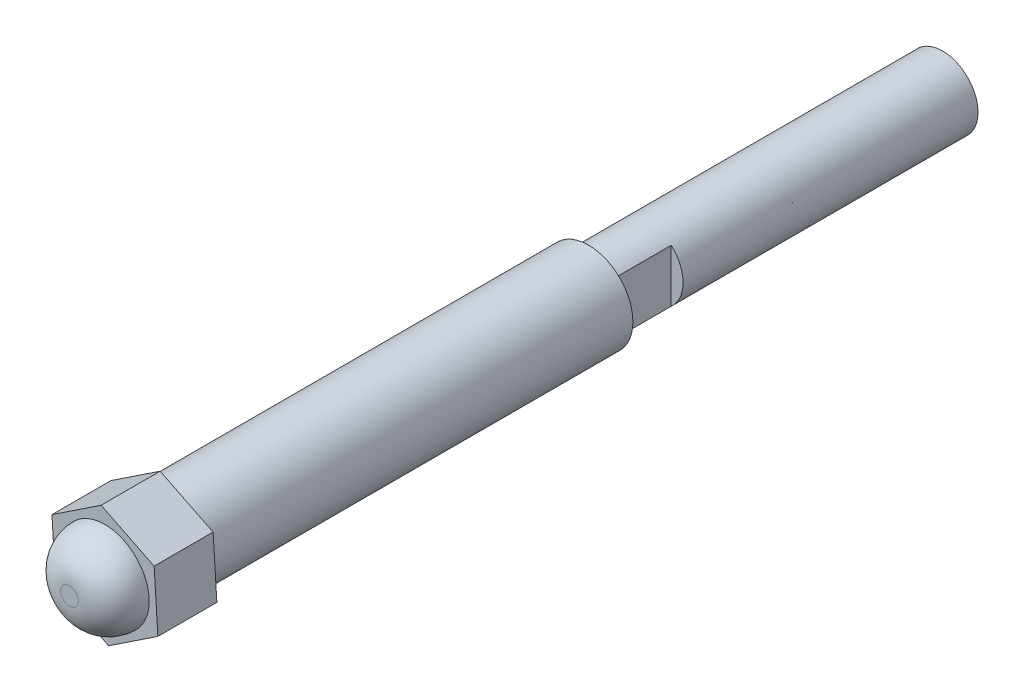
from build123d import *

# Parameters (mm, degrees)
SKETCH1_R           = 4.7625
BOSS_EXTRUDE1_DEPTH = 55.88
SKETCH2_R           = 3.81
BOSS_EXTRUDE2_DEPTH = 38.1
SKETCH3_W           = 1.27
SKETCH3_H           = 6.35
CUT_EXTRUDE1_DEPTH  = 19.05
SKETCH4_R           = 1.5875
CUT_EXTRUDE2_DEPTH  = 38.1
FILLET2_R           = 3.81
BOSS_EXTRUDE3_START = 45.72
BOSS_EXTRUDE3_DEPTH = 6.35


with BuildPart() as part:
    # Sketch1 → Boss-Extrude1 (new body)
    with BuildSketch(Plane.XY):
        Circle(SKETCH1_R)
    extrude(amount=BOSS_EXTRUDE1_DEPTH)

    # Sketch2 → Boss-Extrude2 (add)
    with BuildSketch(Plane(origin=(0, 0, 0), x_dir=(-1, 0, 0), z_dir=(0, 0, -1))):
        with Locations(Location((0, 0, 0), (0, 0, 180))):
            Circle(SKETCH2_R)
    extrude(amount=BOSS_EXTRUDE2_DEPTH)

    # Sketch3 → Cut-Extrude1 (cut, symmetric)
    with BuildSketch(Plane(origin=(0, 0, 0), x_dir=(1, 0, 0), z_dir=(0, 1, 0))):
        with Locations((-3.175, 3.175)):
            Rectangle(SKETCH3_W, SKETCH3_H)
        with Locations((3.175, 3.175)):
            Rectangle(SKETCH3_W, SKETCH3_H)
    extrude(amount=CUT_EXTRUDE1_DEPTH, both=True, mode=Mode.SUBTRACT)

    # Sketch4 → Cut-Extrude2 (cut)
    with BuildSketch(Plane(origin=(0, 0, -38.1), x_dir=(-1, 0, 0), z_dir=(0, 0, -1))):
        Circle(SKETCH4_R)
    extrude(amount=-CUT_EXTRUDE2_DEPTH, mode=Mode.SUBTRACT)

    # Fillet2
    fillet2_edges = [part.edges().sort_by_distance(p)[0] for p in [
        (-4.7625, 0, 55.88),
    ]]
    fillet(fillet2_edges, radius=FILLET2_R)

    # Sketch7 → Boss-Extrude3 (add)
    with BuildSketch(Plane.XY.offset(BOSS_EXTRUDE3_START)):
        Polygon((5.701507332, -2.824699621), (5.297015296, 3.525300379), (-0.404492036, 6.35), (-5.701507332, 2.824699621), (-5.297015296, -3.525300379), (0.404492036, -6.35), align=None)
    extrude(amount=BOSS_EXTRUDE3_DEPTH)


solid = part.part
